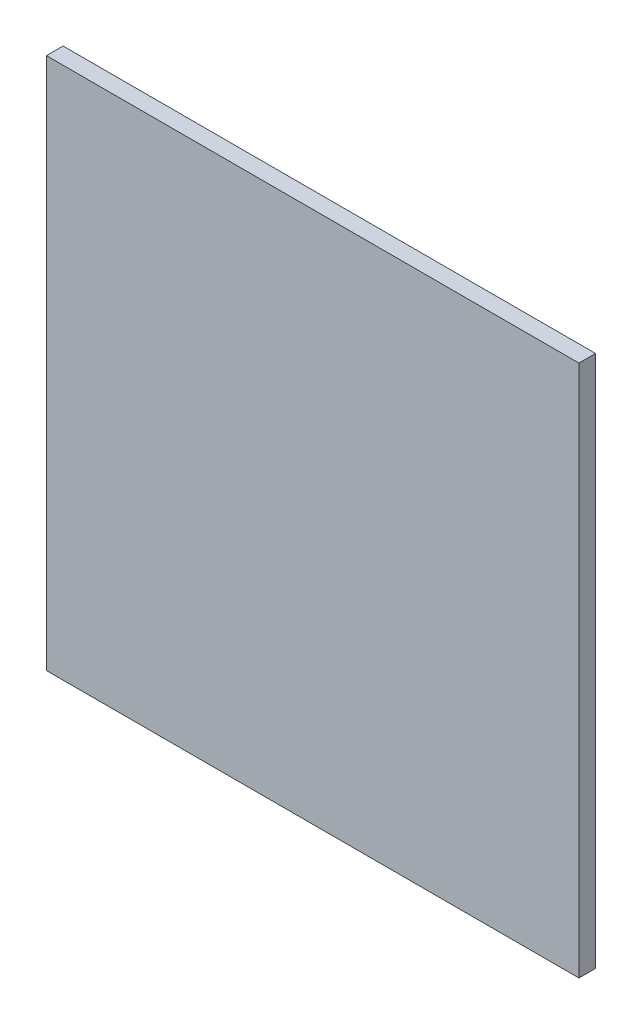
from build123d import *

# Parameters (mm, degrees)
SKETCH1_W           = 609.6
SKETCH1_H           = 609.6
BOSS_EXTRUDE1_DEPTH = 19.05


with BuildPart() as part:
    # Sketch1 → Boss-Extrude1 (new body)
    with BuildSketch(Plane.XY):
        with Locations((304.8, 304.8)):
            Rectangle(SKETCH1_W, SKETCH1_H)
    extrude(amount=BOSS_EXTRUDE1_DEPTH)


solid = part.part
